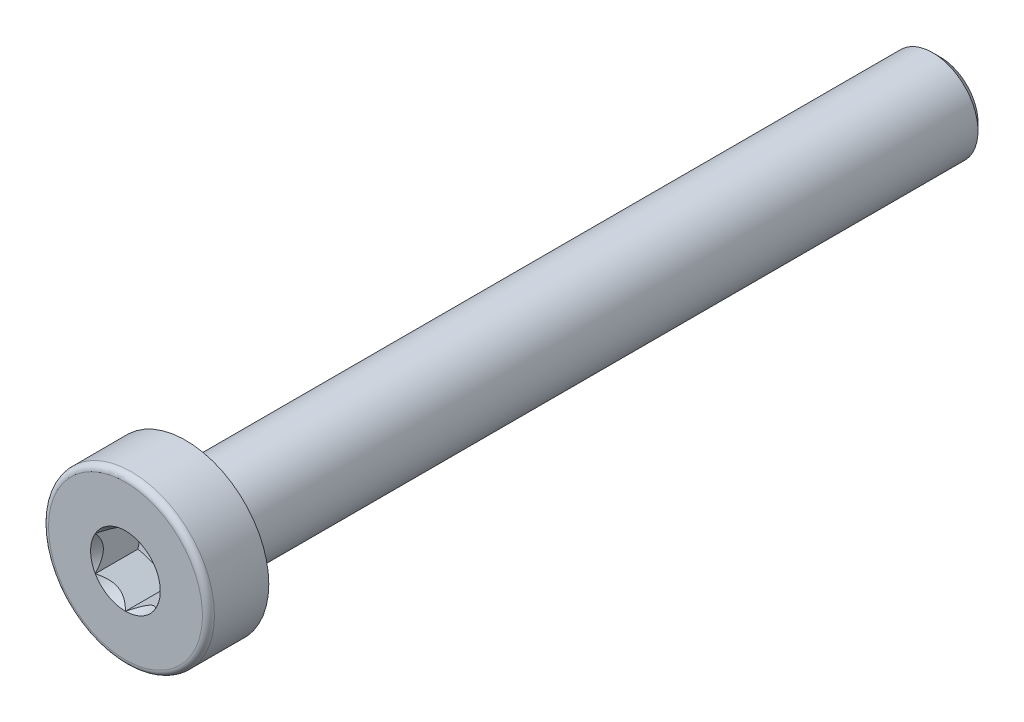
from build123d import *

# Parameters (mm, degrees)
CUT_EXTRUDE1_REACH = 29.279
CHAMFER1_SIZE      = 0.25
FILLET1_R          = 0.2


with BuildPart() as part:
    # Sketch1 → Revolve1 (revolve)
    with BuildSketch(Plane(origin=(0, 0, 0), x_dir=(0, 0, -1), z_dir=(1, 0, 0)), mode=Mode.PRIVATE) as revolve1_sk:
        Polygon((0, 1.5), (0, 2.75), (-2, 2.75), (-2, 0), (25, 0), (25, 1.5), align=None)
    revolve(revolve1_sk.sketch.rotate(Axis((0, 0, 13.782385085), (0, 0, -1)), 90), axis=Axis((0, 0, 13.782385085), (0, 0, -1)))

    # Sketch2 → Cut-Revolve1 (revolve, cut)
    with BuildSketch(Plane(origin=(0, 0, 0), x_dir=(0, 0, -1), z_dir=(1, 0, 0)), mode=Mode.PRIVATE) as cut_revolve1_sk:
        Polygon((0.077350269, 0), (-0.5, 1), (-2, 1), (-2, 0), align=None)
    revolve(cut_revolve1_sk.sketch.rotate(Axis((0, 0, 0), (0, 0, 1)), 90), axis=Axis((0, 0, 0), (0, 0, 1)), mode=Mode.SUBTRACT)

    # Cut-Extrude1: up to this cone (the profile starts inside it)
    cut_extrude1_end = Plane(origin=(0, 0, 2), z_dir=(0, 0, 1)).offset(-2.077349269) * Cone(1.732e-06, 61.408868018, 35.454425481, align=(Align.CENTER, Align.CENTER, Align.MIN), mode=Mode.PRIVATE)
    # Sketch3 → Cut-Extrude1 (cut, up to the surface)
    with BuildSketch(Plane.XY.offset(2), mode=Mode.PRIVATE) as cut_extrude1_sk1:
        Polygon((0, 1.154700538), (-1, 0.577350269), (-1, -0.577350269), (0, -1.154700538), (1, -0.577350269), (1, 0.577350269), align=None)
    cut_extrude1_tool1 = extrude(cut_extrude1_sk1.sketch, amount=-CUT_EXTRUDE1_REACH, mode=Mode.PRIVATE) & cut_extrude1_end
    add(cut_extrude1_tool1.solids().sort_by_distance((0, 0, 2))[0], mode=Mode.SUBTRACT)

    # Sketch4 → Cut-Revolve2 (revolve, cut)
    with BuildSketch(Plane(origin=(0, 0, 0), x_dir=(0, 0, -1), z_dir=(1, 0, 0)), mode=Mode.PRIVATE) as cut_revolve2_sk:
        Polygon((-1.5, 0.866025404), (-2.5, 0.866025404), (-2.5, 1.443375673), align=None)
    revolve(cut_revolve2_sk.sketch.rotate(Axis((0, 0, 0), (0, 0, 1)), 270), axis=Axis((0, 0, 0), (0, 0, 1)), mode=Mode.SUBTRACT)

    # Chamfer1
    chamfer1_edges = [part.edges().sort_by_distance(p)[0] for p in [
        (-1.5, 0, -25),
    ]]
    chamfer(chamfer1_edges, length=CHAMFER1_SIZE)

    # Fillet1
    fillet1_edges = [part.edges().sort_by_distance(p)[0] for p in [
        (-2.75, 0, 2),
    ]]
    fillet(fillet1_edges, radius=FILLET1_R)


solid = part.part
